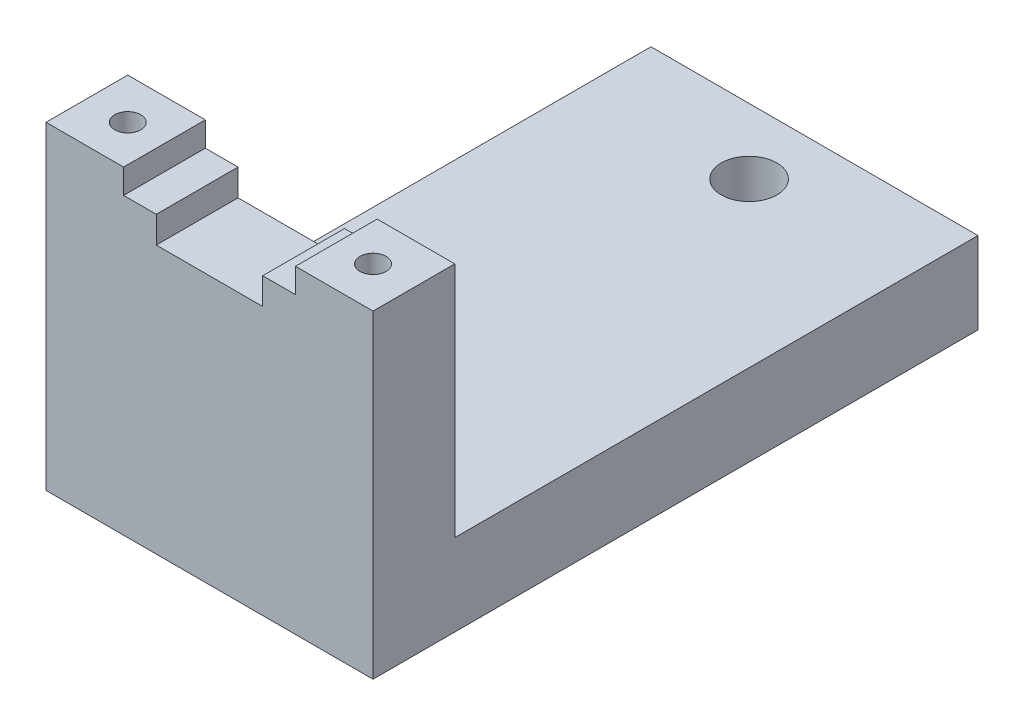
from build123d import *

# Parameters (mm, degrees)
SKETCH2_W                  = 20
SKETCH2_H                  = 37
EXTRUDE1_DEPTH             = 5
F_3_4_3_4_DIAMETER_HOLE1_D = 3.4
LPATTERN1_COUNT            = 2
LPATTERN1_PITCH            = 22.9
SKETCH5_W                  = 20
SKETCH5_H                  = 5
EXTRUDE2_DEPTH             = 14.5
LPATTERN2_COUNT            = 2
LPATTERN2_PITCH            = 15
SKETCH6_W                  = 10.51
SKETCH6_H                  = 5
EXTRUDE3_DEPTH             = 1.5
SKETCH7_W                  = 6.51
SKETCH7_H                  = 5
EXTRUDE4_DEPTH             = 1.63


with BuildPart() as part:
    # Sketch2 → Extrude1 (new body)
    with BuildSketch(Plane(origin=(0, 0, 0), x_dir=(1, 0, 0), z_dir=(0, 1, 0))):
        Rectangle(SKETCH2_W, SKETCH2_H)
    extrude(amount=EXTRUDE1_DEPTH)

    # Ø3.4 (3.4) Diameter Hole1 (through all)
    with Locations(Plane(origin=(0, 0, -14.5), x_dir=(0, 0, -1), z_dir=(0, -1, 0))):
        with Locations((0, 0)):
            f_3_4_3_4_diameter_hole1 = Hole(F_3_4_3_4_DIAMETER_HOLE1_D / 2)

    # LPattern1: Ø3.4 (3.4) Diameter Hole1 ×2
    with Locations(*[(0, 0, i * LPATTERN1_PITCH) for i in range(1, LPATTERN1_COUNT)]):
        add(f_3_4_3_4_diameter_hole1, mode=Mode.SUBTRACT)

    # Sketch5 → Extrude2 (add)
    with BuildSketch(Plane(origin=(0, 5, 0), x_dir=(1, 0, 0), z_dir=(0, 1, 0))):
        with Locations((0, -16)):
            Rectangle(SKETCH5_W, SKETCH5_H)
    extrude(amount=EXTRUDE2_DEPTH)

    # Sketch10 → M2x0.4 Tapped Hole1 (revolve, cut)
    with BuildSketch(Plane(origin=(-7.5, 19.5, 16), x_dir=(0, 0, 1), z_dir=(1, 0, 0))):
        Polygon((0, 0), (0, 8.680688495), (0.8, 8.2), (0.8, 0), align=None)
    m2x0_4_tapped_hole1 = revolve(axis=Axis((-7.5, 25.85, 16), (0, -1, 0)), mode=Mode.SUBTRACT)

    # LPattern2: M2x0.4 Tapped Hole1 ×2
    with Locations(*[(i * LPATTERN2_PITCH, 0, 0) for i in range(1, LPATTERN2_COUNT)]):
        add(m2x0_4_tapped_hole1, mode=Mode.SUBTRACT)

    # Sketch6 → Extrude3 (cut)
    with BuildSketch(Plane(origin=(0, 19.5, 0), x_dir=(-1, 0, 0), z_dir=(0, 1, 0))):
        with Locations((0, 16)):
            Rectangle(SKETCH6_W, SKETCH6_H)
    extrude(amount=-EXTRUDE3_DEPTH, mode=Mode.SUBTRACT)

    # Sketch7 → Extrude4 (cut)
    with BuildSketch(Plane(origin=(0, 18, 0), x_dir=(-1, 0, 0), z_dir=(0, 1, 0))):
        with Locations((0, 16)):
            Rectangle(SKETCH7_W, SKETCH7_H)
    extrude(amount=-EXTRUDE4_DEPTH, mode=Mode.SUBTRACT)


solid = part.part
